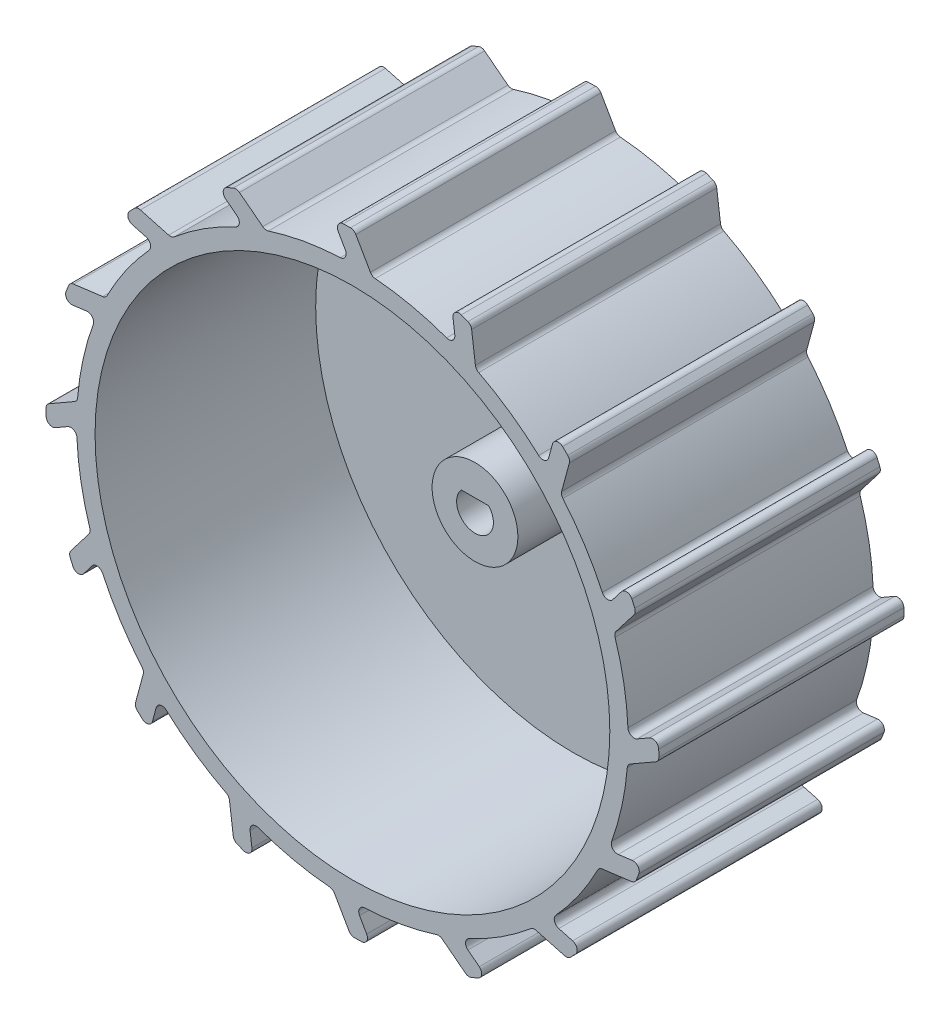
from build123d import *

# Parameters (mm, degrees)
SKETCH1_R                = 21
SKETCH1_R_2              = 3.5
BOSS_EXTRUDE2_DEPTH      = 2
SKETCH1_4_R              = 22.5
SKETCH1_4_R_2            = 21
BOSS_EXTRUDE3_DEPTH      = 20
BOSS_EXTRUDE4_DEPTH      = 20
FILLET1_R                = 0.5
CIRPATTERN1_COUNT        = 16
FILLET1_OF_CIRPATTERN1_R = 0.5
SKETCH1_6_R              = 3.5
BOSS_EXTRUDE5_DEPTH      = 10
DRAFT1_ANGLE             = -1


with BuildPart() as part:
    # Sketch1 → Boss-Extrude2 (new body)
    with BuildSketch(Plane.XY):
        Circle(SKETCH1_R)
        Circle(SKETCH1_R_2, mode=Mode.SUBTRACT)
    extrude(amount=BOSS_EXTRUDE2_DEPTH)

    # Sketch1<4> → Boss-Extrude3 (add)
    with BuildSketch(Plane.XY):
        Circle(SKETCH1_4_R)
        Circle(SKETCH1_4_R_2, mode=Mode.SUBTRACT)
    extrude(amount=BOSS_EXTRUDE3_DEPTH)

    # Sketch1<5> → Boss-Extrude4 (add)
    with BuildSketch(Plane.XY):
        with BuildLine():
            ThreePointArc((0.13161991, 24.999653522), (-0.719679971, 24.989639068), (-1.570145241, 24.950644158))
            Line((-1.570145241, 24.950644158), (-0.161901615, 22.499417501))
            ThreePointArc((-0.161901615, 22.499417501), (0.719815444, 22.488482957), (1.600426946, 22.443008568))
            Line((1.600426946, 22.443008568), (0.13161991, 24.999653522))
        make_face()
    boss_extrude4 = extrude(amount=BOSS_EXTRUDE4_DEPTH)

    # Fillet1
    fillet1_edges = [part.edges().sort_by_distance(p)[0] for p in [
        (-0.161901615, 22.499417501, 10),
        (1.600426946, 22.443008568, 10),
        (0.13161991, 24.999653522, 10),
        (-1.570145241, 24.950644158, 10),
    ]]
    fillet(fillet1_edges, radius=FILLET1_R)

    # CirPattern1: Boss-Extrude4 ×16 about axis
    cirpattern1_axis = Axis((0, 0, 0), (0, 0, 1))
    for i in range(1, CIRPATTERN1_COUNT):
        add(boss_extrude4.rotate(cirpattern1_axis, i * 360 / CIRPATTERN1_COUNT))

    # Fillet1 of CirPattern1
    fillet1_of_cirpattern1_edges = [part.edges().sort_by_distance(p)[0] for p in [
        (-8.759731904, 20.724794257, 10),
        (-7.109965853, 21.347093141, 10),
        (-9.445352276, 23.147036968, 10),
        (-10.998823198, 22.450520891, 10),
        (-16.023972417, 15.795008958, 10),
        (-14.737930803, 17.001276295, 10),
        (-17.584355201, 17.770493864, 10),
        (-18.753030027, 16.532509332, 10),
        (-20.848708388, 8.460576727, 10),
        (-20.122179387, 10.06716925, 10),
        (-23.046299449, 9.688554159, 10),
        (-23.652258031, 8.097573095, 10),
        (-22.499417501, -0.161901615, 10),
        (-22.443008568, 1.600426946, 10),
        (-24.999653522, 0.13161991, 10),
        (-24.950644158, -1.570145241, 10),
        (-20.724794257, -8.759731904, 10),
        (-21.347093141, -7.109965853, 10),
        (-23.147036968, -9.445352276, 10),
        (-22.450520891, -10.998823198, 10),
        (-15.795008958, -16.023972417, 10),
        (-17.001276295, -14.737930803, 10),
        (-17.770493864, -17.584355201, 10),
        (-16.532509332, -18.753030027, 10),
        (-8.460576727, -20.848708388, 10),
        (-10.06716925, -20.122179387, 10),
        (-9.688554159, -23.046299449, 10),
        (-8.097573095, -23.652258031, 10),
        (0.161901615, -22.499417501, 10),
        (-1.600426946, -22.443008568, 10),
        (-0.13161991, -24.999653522, 10),
        (1.570145241, -24.950644158, 10),
        (8.759731904, -20.724794257, 10),
        (7.109965853, -21.347093141, 10),
        (9.445352276, -23.147036968, 10),
        (10.998823198, -22.450520891, 10),
        (16.023972417, -15.795008958, 10),
        (14.737930803, -17.001276295, 10),
        (17.584355201, -17.770493864, 10),
        (18.753030027, -16.532509332, 10),
        (20.848708388, -8.460576727, 10),
        (20.122179387, -10.06716925, 10),
        (23.046299449, -9.688554159, 10),
        (23.652258031, -8.097573095, 10),
        (22.499417501, 0.161901615, 10),
        (22.443008568, -1.600426946, 10),
        (24.999653522, -0.13161991, 10),
        (24.950644158, 1.570145241, 10),
        (20.724794257, 8.759731904, 10),
        (21.347093141, 7.109965853, 10),
        (23.147036968, 9.445352276, 10),
        (22.450520891, 10.998823198, 10),
        (15.795008958, 16.023972417, 10),
        (17.001276295, 14.737930803, 10),
        (17.770493864, 17.584355201, 10),
        (16.532509332, 18.753030027, 10),
        (8.460576727, 20.848708388, 10),
        (10.06716925, 20.122179387, 10),
        (9.688554159, 23.046299449, 10),
        (8.097573095, 23.652258031, 10),
    ]]
    fillet(fillet1_of_cirpattern1_edges, radius=FILLET1_OF_CIRPATTERN1_R)

    # Sketch1<6> → Boss-Extrude5 (add)
    with BuildSketch(Plane.XY):
        Circle(SKETCH1_6_R)
        with BuildLine():
            Line((-1.118033989, 1), (1.118033989, 1))
            ThreePointArc((1.118033989, 1), (0, -1.5), (-1.118033989, 1))
        make_face(mode=Mode.SUBTRACT)
    extrude(amount=BOSS_EXTRUDE5_DEPTH)

    # Draft1
    draft1_faces = [part.faces().sort_by_distance(p)[0] for p in [
        (0, 1, 5),
        (0, -1.5, 5),
    ]]
    draft(draft1_faces, Plane.XY.offset(10), DRAFT1_ANGLE)


solid = part.part
